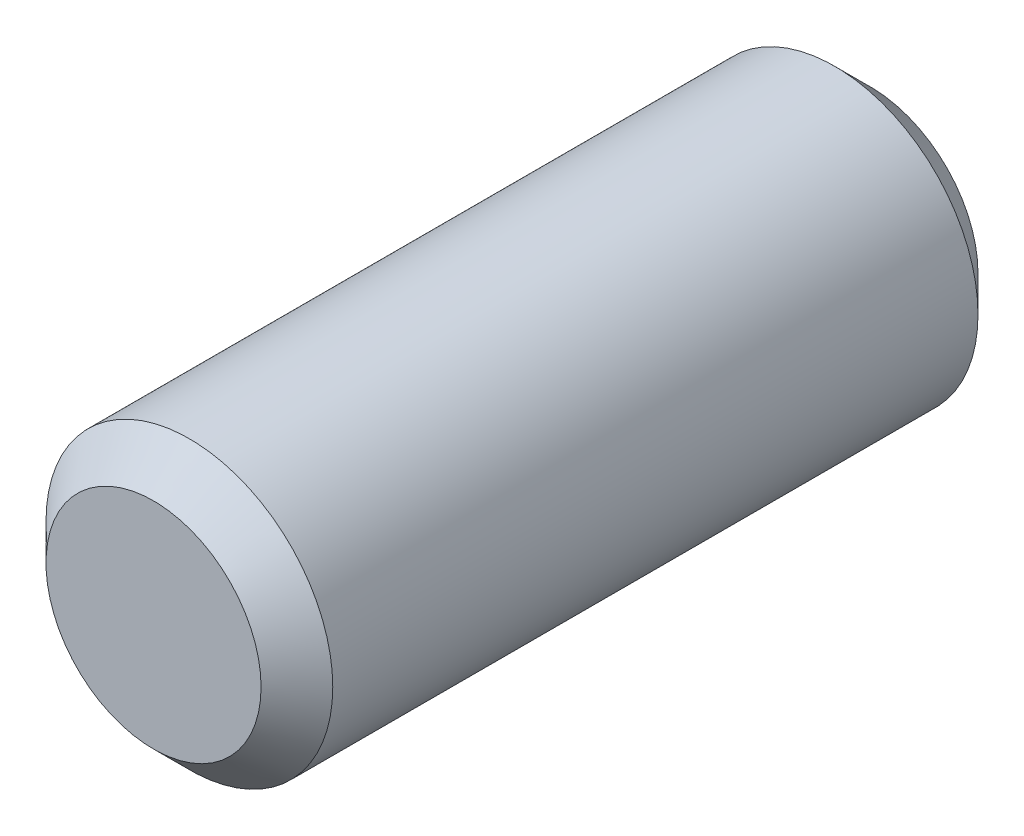
from build123d import *

# Parameters (mm, degrees)
SKETCH1_R           = 4
BOSS_EXTRUDE1_DEPTH = 10
CHAMFER1_SIZE       = 1


with BuildPart() as part:
    # Sketch1 → Boss-Extrude1 (new, symmetric)
    with BuildSketch(Plane.XY):
        Circle(SKETCH1_R)
    extrude(amount=BOSS_EXTRUDE1_DEPTH, both=True)

    # Chamfer1
    chamfer1_edges = [part.edges().sort_by_distance(p)[0] for p in [
        (-4, 0, -10),
        (-4, 0, 10),
    ]]
    chamfer(chamfer1_edges, length=CHAMFER1_SIZE)


solid = part.part
